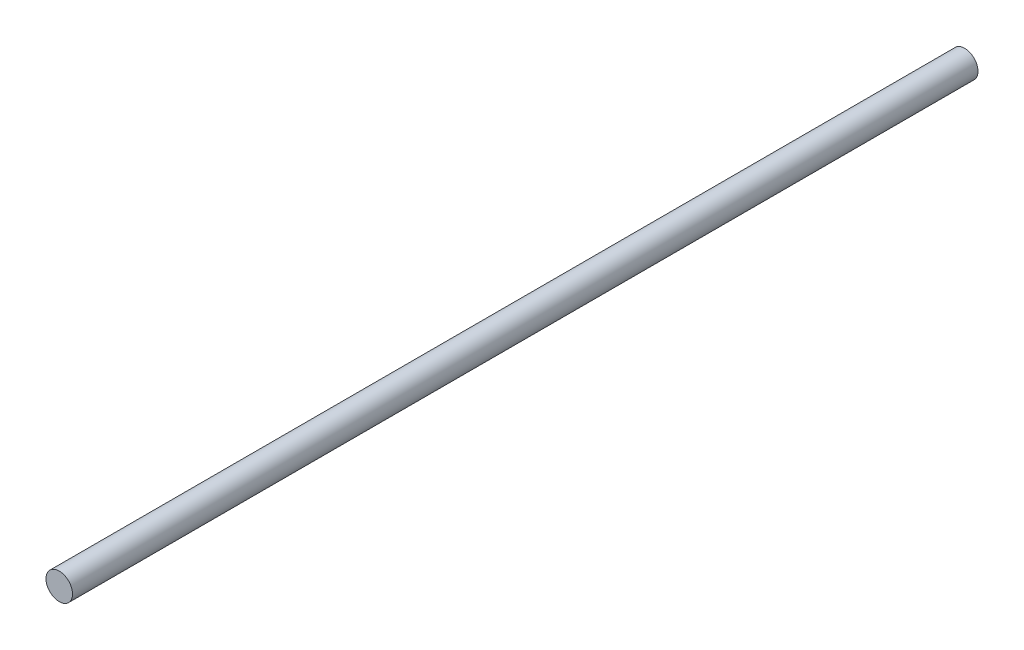
from build123d import *

# Parameters (mm, degrees)
SZKIC1_R                    = 10
DODANIE_WYCI_GNI_CIE1_DEPTH = 682.34


with BuildPart() as part:
    # Szkic1 → Dodanie-wyciągnięcie1 (new body)
    with BuildSketch(Plane.XY):
        Circle(SZKIC1_R)
    extrude(amount=DODANIE_WYCI_GNI_CIE1_DEPTH)


solid = part.part
